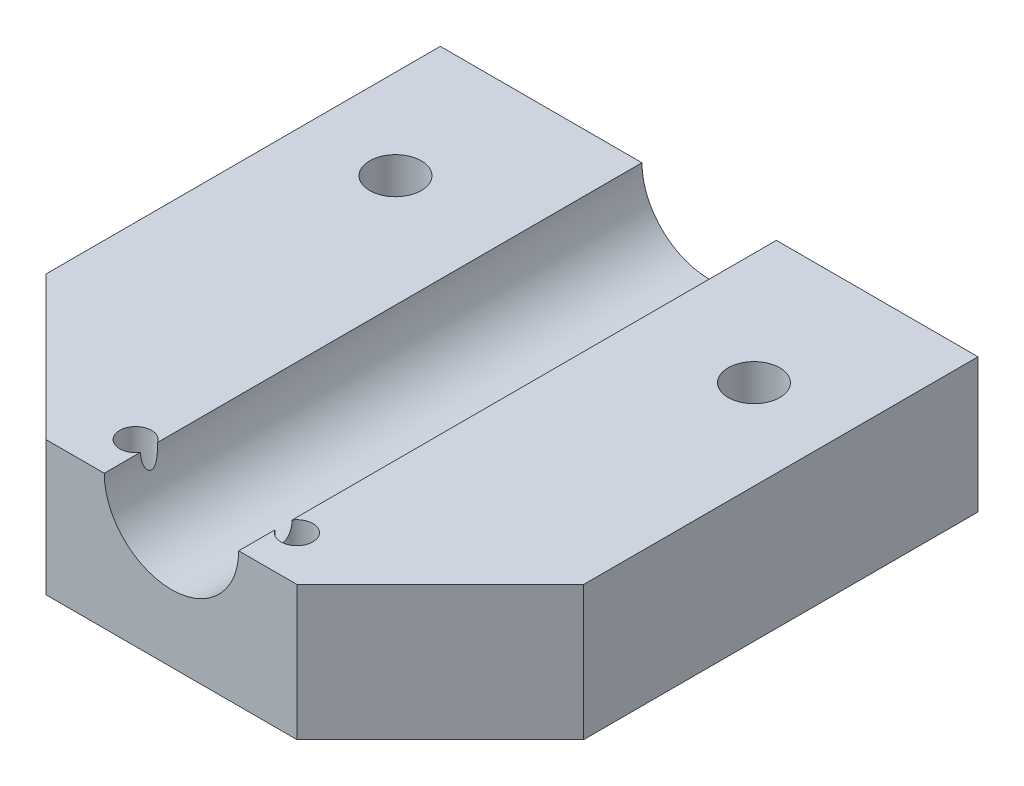
from build123d import *

# Parameters (mm, degrees)
SKETCH1_W                                     = 38.1
SKETCH1_H                                     = 38.1
BOSS_EXTRUDE1_DEPTH                           = 9.525
SKETCH4_R                                     = 4.7625
CUT_EXTRUDE1_DEPTH                            = 44.649033494
MOTORHOLES_D                                  = 2.2606
CBORE_FOR_6_SOCKET_HEAD_CAP_SCREW1_AT_2_COUNT = 2
CBORE_FOR_6_SOCKET_HEAD_CAP_SCREW1_AT_2_PITCH = 25.4
CHAMFER1_SIZE                                 = 10.16


with BuildPart() as part:
    # Sketch1 → Boss-Extrude1 (new body)
    with BuildSketch(Plane(origin=(0, 0, 0), x_dir=(1, 0, 0), z_dir=(0, 1, 0))):
        Rectangle(SKETCH1_W, SKETCH1_H)
    extrude(amount=BOSS_EXTRUDE1_DEPTH)

    # Sketch4 → Cut-Extrude1 (cut, through all)
    with BuildSketch(Plane.XY.offset(19.05)):
        with Locations((0, 9.525)):
            Circle(SKETCH4_R)
    extrude(amount=-CUT_EXTRUDE1_DEPTH, mode=Mode.SUBTRACT)

    # MotorHoles (through all)
    with Locations(Plane(origin=(0, 0, 0), x_dir=(-1, 0, 0), z_dir=(0, -1, 0))):
        with Locations((-5.715, -15.875), (5.715, -15.875)):
            Hole(MOTORHOLES_D / 2)

    # Sketch5 → CBORE for #6 Socket Head Cap Screw1 (revolve, cut)
    with BuildSketch(Plane(origin=(12.7, 0, -9.525), x_dir=(0, 0, -1), z_dir=(1, 0, 0))):
        Polygon((0, 0), (0, 9.525), (1.8288, 9.525), (1.8288, 3.5052), (3.57251, 3.5052), (3.57251, 0.635), (4.20751, 0), align=None)
    cbore_for_6_socket_head_cap_screw1 = revolve(axis=Axis((12.7, -6.35, -9.525), (0, 1, 0)), mode=Mode.SUBTRACT)

    # CBORE for #6 Socket Head Cap Screw1 at 2: CBORE for #6 Socket Head Cap Screw1 ×2
    with Locations(*[(-i * CBORE_FOR_6_SOCKET_HEAD_CAP_SCREW1_AT_2_PITCH, 0, 0) for i in range(1, CBORE_FOR_6_SOCKET_HEAD_CAP_SCREW1_AT_2_COUNT)]):
        add(cbore_for_6_socket_head_cap_screw1, mode=Mode.SUBTRACT)

    # Chamfer1
    chamfer1_edges = [part.edges().sort_by_distance(p)[0] for p in [
        (19.05, 4.7625, 19.05),
        (-19.05, 4.7625, 19.05),
    ]]
    chamfer(chamfer1_edges, length=CHAMFER1_SIZE)


solid = part.part
